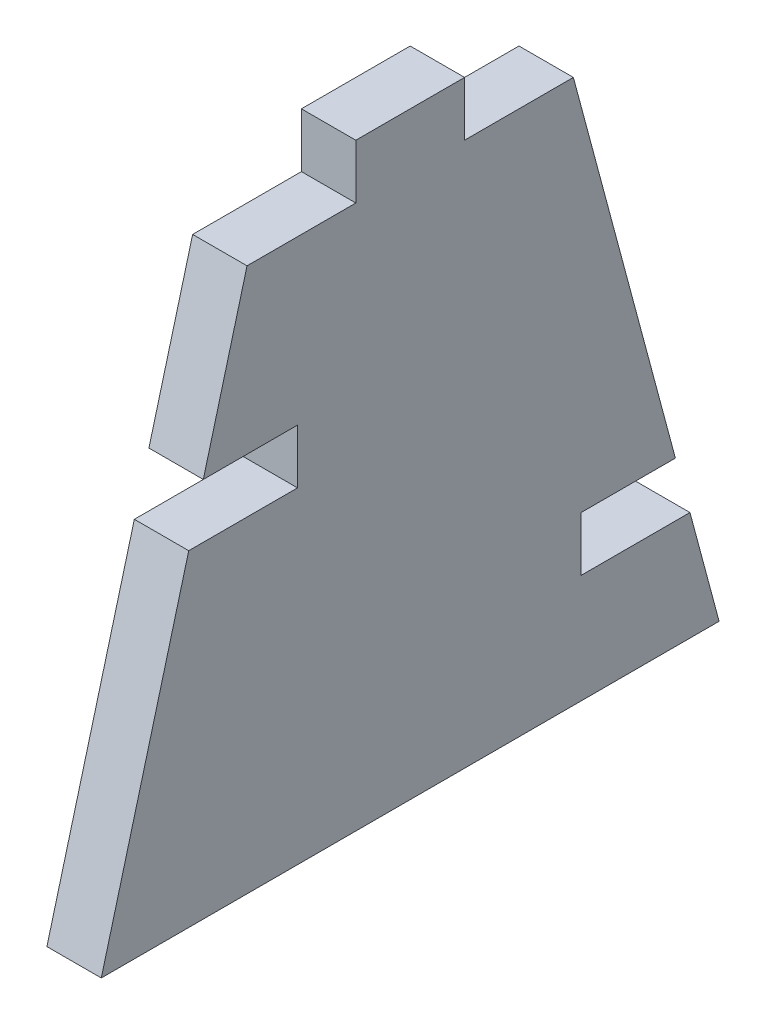
from build123d import *

# Parameters (mm, degrees)
BOSS_EXTRUDE1_DEPTH = 10


with BuildPart() as part:
    # Sketch1 → Boss-Extrude1 (new body)
    with BuildSketch(Plane(origin=(0, 0, 0), x_dir=(0, 0, -1), z_dir=(1, 0, 0))):
        Polygon((56.794919243, 0), (-56.794919243, 0), (-40.717967697, 60), (-20.717967697, 60), (-20.717967697, 70), (-38.038475773, 70), (-30, 100), (-10, 100), (-10, 110), (10, 110), (10, 100), (30, 100), (48.75644347, 30), (31.435935394, 30), (31.435935394, 20), (51.435935394, 20), align=None)
    extrude(amount=BOSS_EXTRUDE1_DEPTH)


solid = part.part
